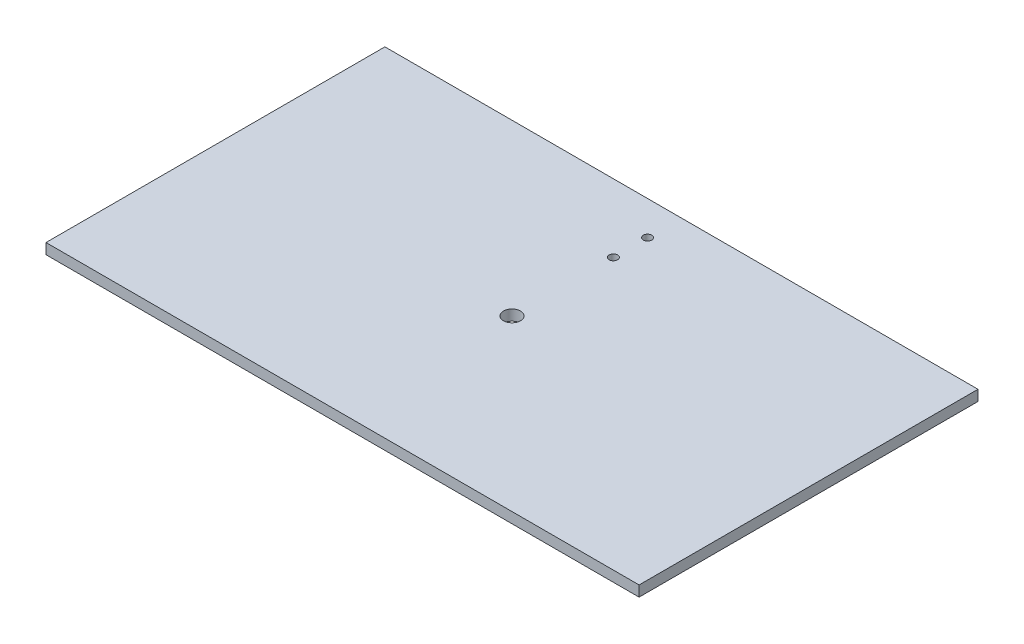
from build123d import *

# Parameters (mm, degrees)
SKETCH2_W                         = 355.6
SKETCH2_H                         = 203.2
BOSS_EXTRUDE1_DEPTH               = 6.35
SKETCH3_R                         = 2.54
CUT_EXTRUDE1_DEPTH                = 205.879775722
TAP_DRILL_FOR_M12X1_75_TAP1_D     = 10.2
TAP_DRILL_FOR_M12X1_75_TAP1_DEPTH = 19.05
TAP_DRILL_FOR_M12X1_75_TAP1_TIP   = 3.064389157


with BuildPart() as part:
    # Sketch2 → Boss-Extrude1 (new body)
    with BuildSketch(Plane(origin=(0, 0, 0), x_dir=(1, 0, 0), z_dir=(0, 1, 0))):
        Rectangle(SKETCH2_W, SKETCH2_H)
    extrude(amount=BOSS_EXTRUDE1_DEPTH)

    # Sketch3 → Cut-Extrude1 (cut, through all)
    with BuildSketch(Plane(origin=(0, 6.35, 0), x_dir=(1, 0, 0), z_dir=(0, 1, 0))):
        with Locations(Location((0, 81.28, 0), (0, 0, 270))):
            Circle(SKETCH3_R)
        with Locations(Location((0, 60.779914, 0), (0, 0, 270))):
            Circle(SKETCH3_R)
    extrude(amount=-CUT_EXTRUDE1_DEPTH, mode=Mode.SUBTRACT)

    # Tap Drill for M12x1.75 Tap1
    with Locations(Plane(origin=(0, 6.35, 0), x_dir=(1, 0, 0), z_dir=(0, 1, 0))):
        with Locations((0, 0)):
            Hole(TAP_DRILL_FOR_M12X1_75_TAP1_D / 2, depth=TAP_DRILL_FOR_M12X1_75_TAP1_DEPTH)
            with Locations((0, 0, -(TAP_DRILL_FOR_M12X1_75_TAP1_DEPTH + TAP_DRILL_FOR_M12X1_75_TAP1_TIP / 2))):  # 118° drill point
                Cone(0, TAP_DRILL_FOR_M12X1_75_TAP1_D / 2, TAP_DRILL_FOR_M12X1_75_TAP1_TIP, mode=Mode.SUBTRACT)


solid = part.part
